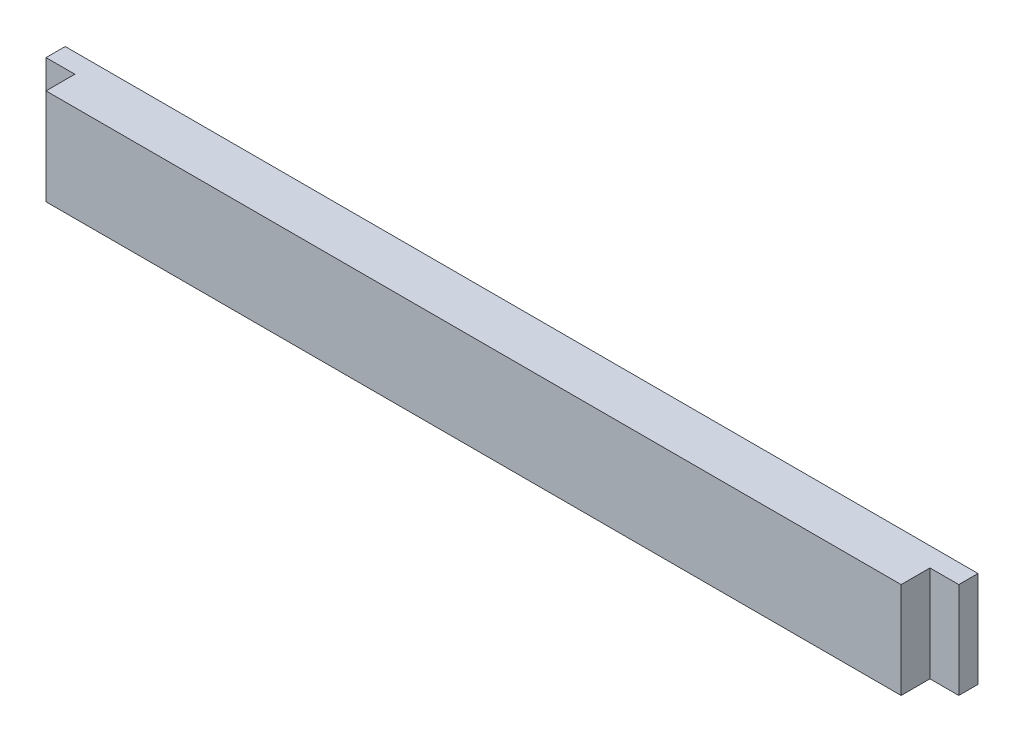
from build123d import *

# Parameters (mm, degrees)
ESQUISSE1_W             = 190
ESQUISSE1_H             = 20
BOSS_EXTRU_1_DEPTH      = 10
ESQUISSE2_W             = 6
ESQUISSE2_H             = 20
ENL_V_MAT_EXTRU_1_DEPTH = 6
ESQUISSE3_R             = 1.5
ENL_V_MAT_EXTRU_2_DEPTH = 6


with BuildPart() as part:
    # Esquisse1 → Boss.-Extru.1 (new body)
    with BuildSketch(Plane.XY):
        Rectangle(ESQUISSE1_W, ESQUISSE1_H)
    extrude(amount=BOSS_EXTRU_1_DEPTH)

    # Esquisse2 → Enlèv. mat.-Extru.1 (cut)
    with BuildSketch(Plane.XY.offset(10)):
        with Locations((-92, 0)):
            Rectangle(ESQUISSE2_W, ESQUISSE2_H)
        with Locations((92, 0)):
            Rectangle(ESQUISSE2_W, ESQUISSE2_H)
    extrude(amount=-ENL_V_MAT_EXTRU_1_DEPTH, mode=Mode.SUBTRACT)

    # Esquisse3 → Enlèv. mat.-Extru.2 (cut)
    with BuildSketch(Plane(origin=(0, 0, 0), x_dir=(-1, 0, 0), z_dir=(0, 0, -1))):
        with Locations((92, 0)):
            Circle(ESQUISSE3_R)
    extrude(amount=-ENL_V_MAT_EXTRU_2_DEPTH, mode=Mode.SUBTRACT)


solid = part.part
